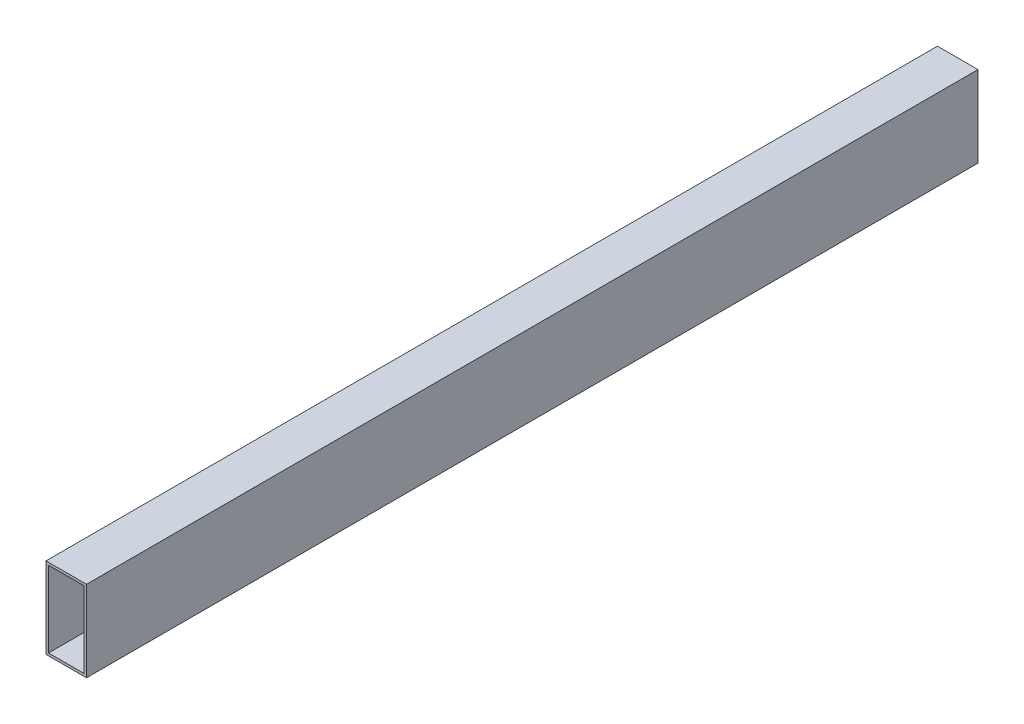
from build123d import *

# Parameters (mm, degrees)
SKETCH1_W           = 25.4
SKETCH1_H           = 50.8
SKETCH1_W_2         = 22.225
SKETCH1_H_2         = 47.625
BOSS_EXTRUDE1_DEPTH = 279.4


with BuildPart() as part:
    # Sketch1 → Boss-Extrude1 (new, symmetric)
    with BuildSketch(Plane.XY):
        Rectangle(SKETCH1_W, SKETCH1_H)
        Rectangle(SKETCH1_W_2, SKETCH1_H_2, mode=Mode.SUBTRACT)
    extrude(amount=BOSS_EXTRUDE1_DEPTH, both=True)


solid = part.part
